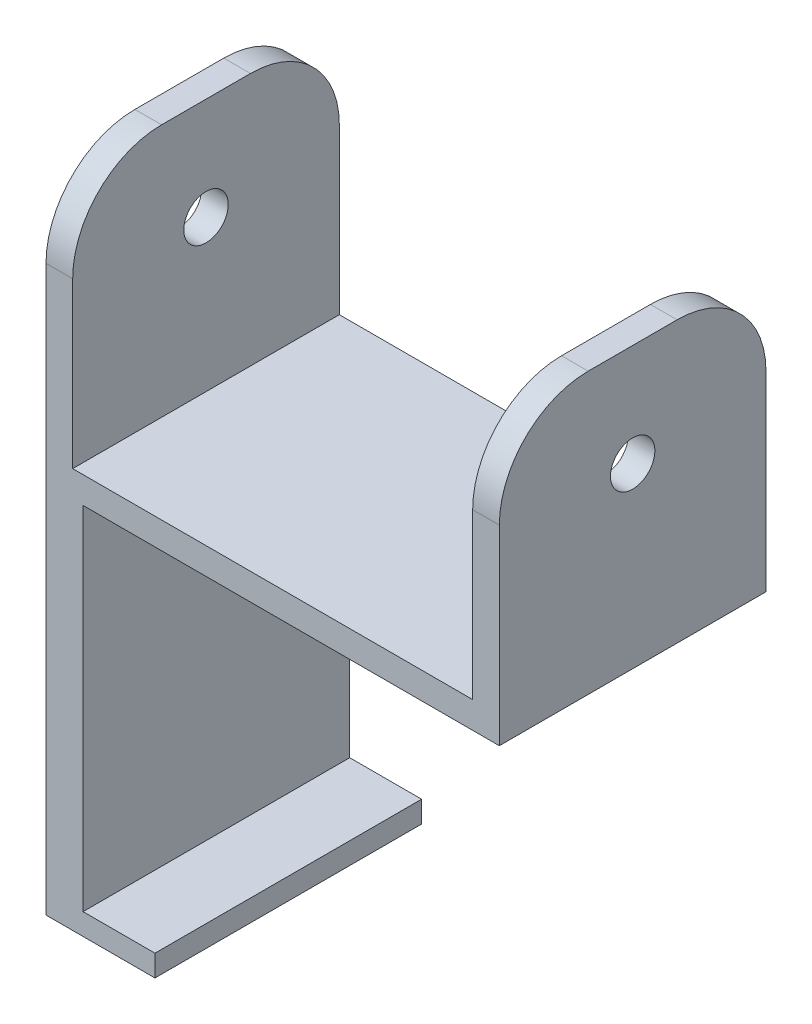
from build123d import *

# Parameters (mm, degrees)
EXTRUDE_THIN1_DEPTH = 15
FILLET1_R           = 10
SKETCH2_R           = 2.5
CUT_EXTRUDE1_DEPTH  = 55
BOSS_EXTRUDE1_DEPTH = 30


with BuildPart() as part:
    # Sketch1 → Extrude-Thin1 (new, symmetric)
    with BuildSketch(Plane.XY):
        Polygon((-23.321428571, 30), (-23.321428571, -1.5), (27.678571429, -1.5), (27.678571429, 30), (24.678571429, 30), (24.678571429, 1.5), (-20.321428571, 1.5), (-20.321428571, 30), align=None)
    extrude(amount=EXTRUDE_THIN1_DEPTH, both=True)

    # Fillet1
    fillet1_edges = [part.edges().sort_by_distance(p)[0] for p in [
        (-21.821428571, 30, 15),
        (26.178571429, 30, 15),
        (-21.821428571, 30, -15),
        (26.178571429, 30, -15),
    ]]
    fillet(fillet1_edges, radius=FILLET1_R)

    # Sketch2 → Cut-Extrude1 (cut)
    with BuildSketch(Plane(origin=(27.678571429, 0, 0), x_dir=(0, 0, -1), z_dir=(1, 0, 0))):
        with Locations((0, 18.5)):
            Circle(SKETCH2_R)
    extrude(amount=-CUT_EXTRUDE1_DEPTH, mode=Mode.SUBTRACT)

    # Sketch4 → Boss-Extrude1 (add)
    with BuildSketch(Plane(origin=(0, 0, -15), x_dir=(-1, 0, 0), z_dir=(0, 0, -1))):
        Polygon((23.321428571, -1.5), (23.321428571, -43.5), (11.065130386, -43.5), (11.065130386, -41.079631184), (19.153220087, -41.079631184), (19.153220087, -1.5), align=None)
    extrude(amount=-BOSS_EXTRUDE1_DEPTH)


solid = part.part
